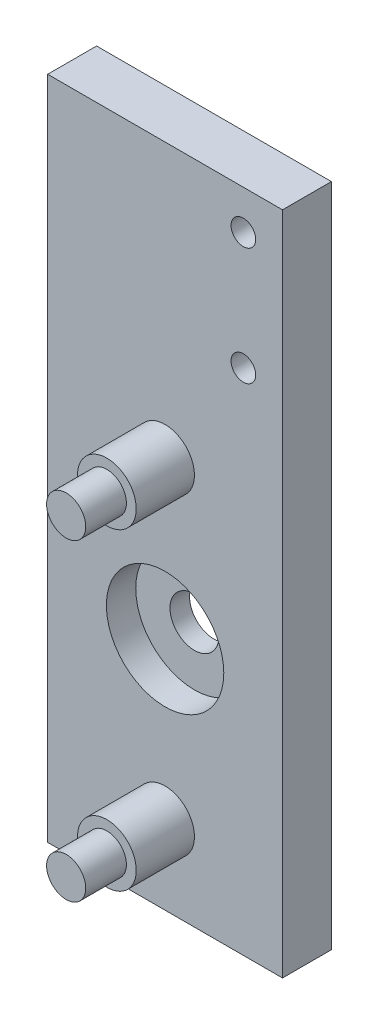
from build123d import *

# Parameters (mm, degrees)
SKETCH1_W           = 38.1
SKETCH1_H           = 76.2
BOSS_EXTRUDE1_DEPTH = 7.9375
SKETCH2_R           = 3.96875
CUT_EXTRUDE1_DEPTH  = 44.330317403
SKETCH4_R           = 9.525
CUT_EXTRUDE2_DEPTH  = 4.7625
SKETCH5_R           = 4.7625
BOSS_EXTRUDE2_DEPTH = 9.4488
SKETCH6_R           = 3.175
BOSS_EXTRUDE3_DEPTH = 6.604
SKETCH7_W           = 38.1
SKETCH7_H           = 31.75
SKETCH7_R           = 2
BOSS_EXTRUDE4_DEPTH = 7.9375


with BuildPart() as part:
    # Sketch1 → Boss-Extrude1 (new body)
    with BuildSketch(Plane.XY):
        Rectangle(SKETCH1_W, SKETCH1_H)
    extrude(amount=BOSS_EXTRUDE1_DEPTH)

    # Sketch2 → Cut-Extrude1 (cut, through all)
    with BuildSketch(Plane.XY.offset(7.9375)):
        Circle(SKETCH2_R)
    extrude(amount=-CUT_EXTRUDE1_DEPTH, mode=Mode.SUBTRACT)

    # Sketch4 → Cut-Extrude2 (cut)
    with BuildSketch(Plane.XY.offset(7.9375)):
        Circle(SKETCH4_R)
    extrude(amount=-CUT_EXTRUDE2_DEPTH, mode=Mode.SUBTRACT)

    # Sketch5 → Boss-Extrude2 (add)
    with BuildSketch(Plane.XY.offset(7.9375)):
        with Locations(Location((0, 25.4, 0), (0, 0, 180))):
            Circle(SKETCH5_R)
    boss_extrude2 = extrude(amount=BOSS_EXTRUDE2_DEPTH)

    # Sketch6 → Boss-Extrude3 (add)
    with BuildSketch(Plane.XY.offset(17.3863)):
        with Locations(Location((0, 25.4, 0), (0, 0, 180))):
            Circle(SKETCH6_R)
    boss_extrude3 = extrude(amount=BOSS_EXTRUDE3_DEPTH)

    # Mirror1: Boss-Extrude2, Boss-Extrude3 across plane
    add(boss_extrude2.mirror(Plane.ZX))
    add(boss_extrude3.mirror(Plane.ZX))

    # Sketch7 → Boss-Extrude4 (add)
    with BuildSketch(Plane.XY.offset(7.9375)):
        with Locations((0, 53.975)):
            Rectangle(SKETCH7_W, SKETCH7_H)
        with Locations((12.7, 63.5)):
            Circle(SKETCH7_R, mode=Mode.SUBTRACT)
        with Locations(Location((12.7, 44.45, 0), (0, 0, 180))):
            Circle(SKETCH7_R, mode=Mode.SUBTRACT)
    extrude(amount=-BOSS_EXTRUDE4_DEPTH)


solid = part.part
